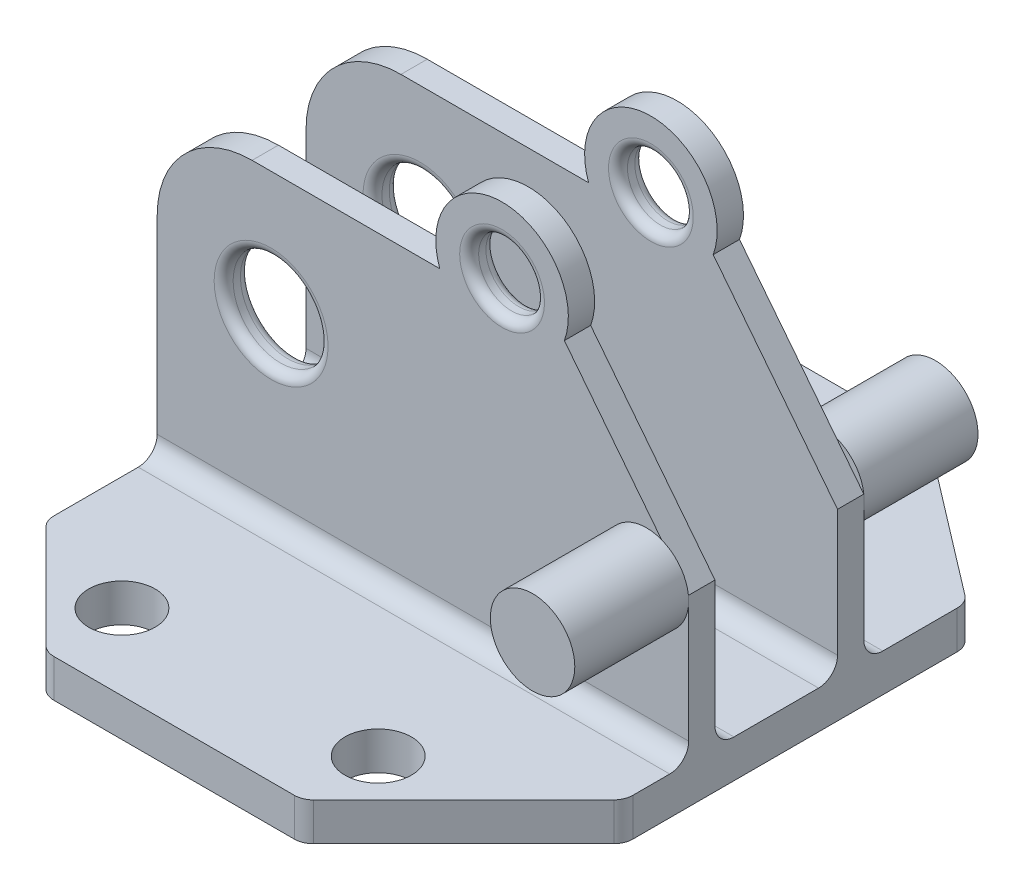
from build123d import *

# Parameters (mm, degrees)
BOSS_EXTRUDE1_DEPTH = 4
SKETCH2_R           = 3.5
CUT_EXTRUDE1_DEPTH  = 4
FILLET1_R           = 2
SKETCH4_W           = 56
SKETCH4_H           = 2.77
BOSS_EXTRUDE2_DEPTH = 32
SKETCH5_R           = 5
CUT_EXTRUDE2_DEPTH  = 79.865842697
CUT_EXTRUDE3_DEPTH  = 79.865842697
SKETCH7_R           = 4.450055897
BOSS_EXTRUDE3_DEPTH = 12
SKETCH8_R           = 4.480606534
BOSS_EXTRUDE4_DEPTH = 12
SKETCH9_R           = 6.984310567
BOSS_EXTRUDE5_DEPTH = 2.77
BOSS_EXTRUDE6_START = -2.77
SKETCH10_R          = 6.984310567
BOSS_EXTRUDE6_DEPTH = 2.77
SKETCH11_R          = 3.46738707
CUT_EXTRUDE4_DEPTH  = 84.523779321
FILLET2_R           = 2
FILLET3_R           = 10
FILLET4_R           = 1
FILLET5_R           = 1


with BuildPart() as part:
    # Sketch1 → Boss-Extrude1 (new body)
    with BuildSketch(Plane(origin=(0, 0, 0), x_dir=(1, 0, 0), z_dir=(0, 1, 0))):
        Polygon((0, 0), (0, -42), (12, -54), (39, -54), (56, -37), (56, -1), (39, 12), (12, 12), align=None)
    extrude(amount=BOSS_EXTRUDE1_DEPTH)

    # Sketch2 → Cut-Extrude1 (cut)
    with BuildSketch(Plane(origin=(0, 4, 0), x_dir=(1, 0, 0), z_dir=(0, 1, 0))):
        with Locations(Location((12, 4, 0), (0, 0, 270))):
            Circle(SKETCH2_R)
        with Locations(Location((39, 4, 0), (0, 0, 270))):
            Circle(SKETCH2_R)
        with Locations(Location((12, -46, 0), (0, 0, 270))):
            Circle(SKETCH2_R)
        with Locations(Location((39, -46, 0), (0, 0, 270))):
            Circle(SKETCH2_R)
    extrude(amount=-CUT_EXTRUDE1_DEPTH, mode=Mode.SUBTRACT)

    # Fillet1
    fillet1_edges = [part.edges().sort_by_distance(p)[0] for p in [
        (39, 2, -12),
        (56, 2, 1),
        (56, 2, 37),
        (39, 2, 54),
        (12, 2, 54),
        (0, 2, 42),
        (0, 2, 0),
        (12, 2, -12),
    ]]
    fillet(fillet1_edges, radius=FILLET1_R)

    # Sketch4 → Boss-Extrude2 (add)
    with BuildSketch(Plane(origin=(0, 4, 0), x_dir=(1, 0, 0), z_dir=(0, 1, 0))):
        with Locations((28, -13.215171539)):
            Rectangle(SKETCH4_W, SKETCH4_H)
        with Locations((28, -28.897634074)):
            Rectangle(SKETCH4_W, SKETCH4_H)
    extrude(amount=BOSS_EXTRUDE2_DEPTH)

    # Sketch5 → Cut-Extrude2 (cut, through all)
    with BuildSketch(Plane.XY.offset(30.282634074)):
        with Locations((12, 23)):
            Circle(SKETCH5_R)
    extrude(amount=-CUT_EXTRUDE2_DEPTH, mode=Mode.SUBTRACT)

    # Sketch6 → Cut-Extrude3 (cut, through all)
    with BuildSketch(Plane.XY.offset(30.282634074)):
        Polygon((42.90022554, 36), (56, 19.316551284), (56, 36), align=None)
    extrude(amount=-CUT_EXTRUDE3_DEPTH, mode=Mode.SUBTRACT)

    # Sketch7 → Boss-Extrude3 (add)
    with BuildSketch(Plane.XY.offset(30.282634074)):
        with Locations((51.549944103, 18.794212858)):
            Circle(SKETCH7_R)
    extrude(amount=BOSS_EXTRUDE3_DEPTH)

    # Sketch8 → Boss-Extrude4 (add)
    with BuildSketch(Plane(origin=(0, 0, 11.830171539), x_dir=(-1, 0, 0), z_dir=(0, 0, -1))):
        with Locations(Location((-51.549944103, 18.794212858, 0), (0, 0, 186.694627875))):
            Circle(SKETCH8_R)
    extrude(amount=BOSS_EXTRUDE4_DEPTH)

    # Sketch9 → Boss-Extrude5 (add)
    with BuildSketch(Plane.XY.offset(30.282634074)):
        with Locations((36.336269743, 38.38643634)):
            Circle(SKETCH9_R)
    extrude(amount=-BOSS_EXTRUDE5_DEPTH)

    # Sketch10 → Boss-Extrude6 (add)
    with BuildSketch(Plane(origin=(0, 0, 11.830171539), x_dir=(-1, 0, 0), z_dir=(0, 0, -1)).offset(BOSS_EXTRUDE6_START)):
        with Locations((-36.336269743, 38.38643634)):
            Circle(SKETCH10_R)
    extrude(amount=BOSS_EXTRUDE6_DEPTH)

    # Sketch11 → Cut-Extrude4 (cut, through all)
    with BuildSketch(Plane(origin=(0, 0, 11.830171539), x_dir=(-1, 0, 0), z_dir=(0, 0, -1))):
        with Locations((-36.336269743, 38.38643634)):
            Circle(SKETCH11_R)
    extrude(amount=-CUT_EXTRUDE4_DEPTH, mode=Mode.SUBTRACT)

    # Fillet2
    fillet2_edges = [part.edges().sort_by_distance(p)[0] for p in [
        (28, 4, 14.600171539),
        (28, 4, 11.830171539),
        (28, 4, 30.282634074),
        (28, 4, 27.512634074),
    ]]
    fillet(fillet2_edges, radius=FILLET2_R)

    # Fillet3
    fillet3_edges = [part.edges().sort_by_distance(p)[0] for p in [
        (0, 36, 13.215171539),
        (0, 36, 28.897634074),
    ]]
    fillet(fillet3_edges, radius=FILLET3_R)

    # Fillet4
    fillet4_edges = [part.edges().sort_by_distance(p)[0] for p in [
        (39.803656813, 38.38643634, 14.600171539),
        (39.803656813, 38.38643634, 27.512634074),
        (39.803656813, 38.38643634, 30.282634074),
        (39.803656813, 38.38643634, 11.830171539),
    ]]
    fillet(fillet4_edges, radius=FILLET4_R)

    # Fillet5
    fillet5_edges = [part.edges().sort_by_distance(p)[0] for p in [
        (7, 23, 11.830171539),
        (7, 23, 14.600171539),
        (7, 23, 27.512634074),
        (7, 23, 30.282634074),
    ]]
    fillet(fillet5_edges, radius=FILLET5_R)


solid = part.part
